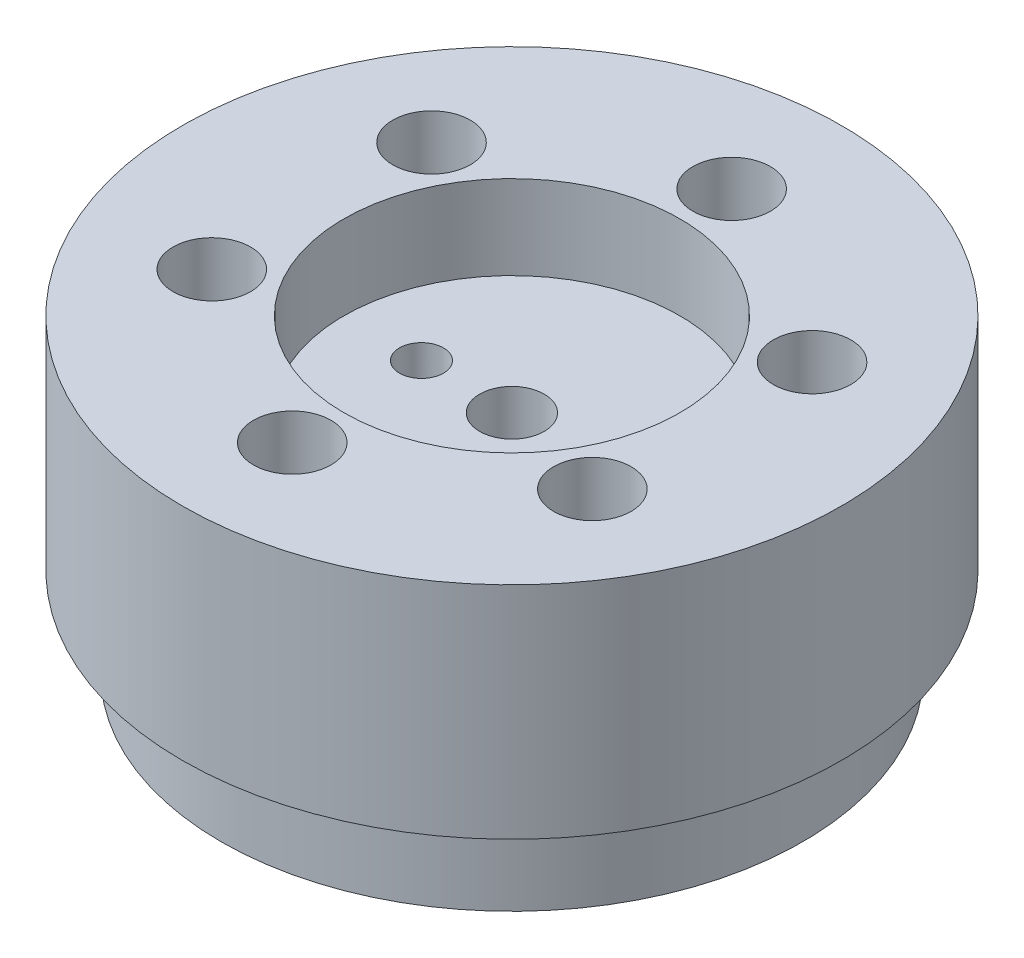
from build123d import *

# Parameters (mm, degrees)
SKETCH2_R            = 22.5
SKETCH2_R_2          = 1.7
SKETCH2_R_3          = 3
BOSS_EXTRUDE1_DEPTH  = 20
SKETCH2_6_R          = 22.5
SKETCH2_6_R_2        = 3
SKETCH2_6_R_3        = 13
SKETCH2_6_R_4        = 1.7
BOSS_EXTRUDE4_DEPTH  = 24
SKETCH2_8_W          = 22.604282846
SKETCH2_8_H          = 12.847038452
SKETCH2_8_R          = 2.5
CUT_EXTRUDE1_DEPTH   = 20
SKETCH2_9_W          = 22.604282846
SKETCH2_9_H          = 12.847038452
SKETCH2_9_R          = 1.7
SKETCH2_9_R_2        = 2.5
BOSS_EXTRUDE6_DEPTH  = 20
SKETCH2_10_W         = 22.604282846
SKETCH2_10_H         = 12.847038452
SKETCH2_10_R         = 1.7
SKETCH2_10_R_2       = 2.5
CUT_EXTRUDE2_DEPTH   = 15
FILLET3_R            = 3
SKETCH2_11_R         = 3
CUT_EXTRUDE3_DEPTH   = 24
CUT_EXTRUDE4_START   = -2.5
SKETCH3_R            = 13
CUT_EXTRUDE4_DEPTH   = 2.5
SKETCH2_13_R         = 3
SKETCH2_13_R_2       = 1.7
BOSS_EXTRUDE7_DEPTH  = 10
BOSS_EXTRUDE8_START  = -10
SKETCH4_R            = 25.5
SKETCH4_R_2          = 22.5
BOSS_EXTRUDE8_DEPTH  = 14
SKETCH5_R            = 3
SKETCH5_R_2          = 2.5
SKETCH5_R_3          = 1.7
BOSS_EXTRUDE9_DEPTH  = 2
SKETCH6_R            = 1.7
SKETCH6_R_2          = 2.5
BOSS_EXTRUDE10_DEPTH = 10
SKETCH7_R            = 2.5
SKETCH7_R_2          = 1.7
CUT_EXTRUDE5_DEPTH   = 4
BOSS_EXTRUDE11_START = -6.95
SKETCH4_2_R          = 25.5
SKETCH4_2_R_2        = 22.5
BOSS_EXTRUDE11_DEPTH = 3.05


with BuildPart() as part:
    # Sketch2 → Boss-Extrude1 (new body)
    with BuildSketch(Plane(origin=(0, 0, 0), x_dir=(1, 0, 0), z_dir=(0, 1, 0))):
        with Locations(Location((0, 0, 0), (0, 0, 270))):
            Circle(SKETCH2_R)
        with Locations(Location((-7, 0, 0), (0, 0, 270))):
            Circle(SKETCH2_R_2, mode=Mode.SUBTRACT)
        with Locations(Location((7, 0, 0), (0, 0, 270))):
            Circle(SKETCH2_R_2, mode=Mode.SUBTRACT)
        with Locations(Location((0, -17, 0), (0, 0, 270))):
            Circle(SKETCH2_R_2, mode=Mode.SUBTRACT)
        with Locations(Location((0, 17, 0), (0, 0, 270))):
            Circle(SKETCH2_R_2, mode=Mode.SUBTRACT)
        with Locations(Location((-14.722431864, -8.5, 0), (0, 0, 270))):
            Circle(SKETCH2_R_3, mode=Mode.SUBTRACT)
        with Locations(Location((-14.722431864, 8.5, 0), (0, 0, 270))):
            Circle(SKETCH2_R_3, mode=Mode.SUBTRACT)
        with Locations(Location((14.722431864, 8.5, 0), (0, 0, 270))):
            Circle(SKETCH2_R_3, mode=Mode.SUBTRACT)
        with Locations(Location((14.722431864, -8.5, 0), (0, 0, 270))):
            Circle(SKETCH2_R_3, mode=Mode.SUBTRACT)
    extrude(amount=BOSS_EXTRUDE1_DEPTH)

    # Sketch2<6> → Boss-Extrude4 (add)
    with BuildSketch(Plane(origin=(0, 0, 0), x_dir=(1, 0, 0), z_dir=(0, 1, 0))):
        with Locations(Location((0, 0, 0), (0, 0, 270))):
            Circle(SKETCH2_6_R)
        with Locations(Location((-14.722431864, -8.5, 0), (0, 0, 270))):
            Circle(SKETCH2_6_R_2, mode=Mode.SUBTRACT)
        with Locations(Location((14.722431864, -8.5, 0), (0, 0, 270))):
            Circle(SKETCH2_6_R_2, mode=Mode.SUBTRACT)
        with Locations(Location((-14.722431864, 8.5, 0), (0, 0, 270))):
            Circle(SKETCH2_6_R_2, mode=Mode.SUBTRACT)
        with Locations(Location((0, 0, 0), (0, 0, 270))):
            Circle(SKETCH2_6_R_3, mode=Mode.SUBTRACT)
        with Locations(Location((14.722431864, 8.5, 0), (0, 0, 270))):
            Circle(SKETCH2_6_R_2, mode=Mode.SUBTRACT)
        with Locations(Location((0, 17, 0), (0, 0, 270))):
            Circle(SKETCH2_6_R_4, mode=Mode.SUBTRACT)
        with Locations(Location((0, -17, 0), (0, 0, 270))):
            Circle(SKETCH2_6_R_4, mode=Mode.SUBTRACT)
    extrude(amount=BOSS_EXTRUDE4_DEPTH)

    # Sketch2<8> → Cut-Extrude1 (cut)
    # profile 1 of 2: a face of its own
    with BuildSketch(Plane(origin=(0, 0, 0), x_dir=(1, 0, 0), z_dir=(0, 1, 0))):
        Rectangle(SKETCH2_8_W, SKETCH2_8_H)
        Circle(SKETCH2_8_R, mode=Mode.SUBTRACT)
    # profile 2 of 2: a face of its own
    with BuildSketch(Plane(origin=(0, 0, 0), x_dir=(1, 0, 0), z_dir=(0, 1, 0))):
        Circle(SKETCH2_8_R)
    extrude(amount=CUT_EXTRUDE1_DEPTH, mode=Mode.SUBTRACT)

    # Sketch2<9> → Boss-Extrude6 (add)
    with BuildSketch(Plane(origin=(0, 0, 0), x_dir=(1, 0, 0), z_dir=(0, 1, 0))):
        Rectangle(SKETCH2_9_W, SKETCH2_9_H)
        with Locations(Location((-7, 0, 0), (0, 0, 270))):
            Circle(SKETCH2_9_R, mode=Mode.SUBTRACT)
        with Locations(Location((0, 0, 0), (0, 0, 270))):
            Circle(SKETCH2_9_R_2, mode=Mode.SUBTRACT)
        with Locations(Location((7, 0, 0), (0, 0, 270))):
            Circle(SKETCH2_9_R, mode=Mode.SUBTRACT)
    extrude(amount=BOSS_EXTRUDE6_DEPTH)

    # Sketch2<10> → Cut-Extrude2 (cut)
    with BuildSketch(Plane(origin=(0, 0, 0), x_dir=(1, 0, 0), z_dir=(0, 1, 0))):
        Rectangle(SKETCH2_10_W, SKETCH2_10_H)
        with Locations(Location((7, 0, 0), (0, 0, 270))):
            Circle(SKETCH2_10_R, mode=Mode.SUBTRACT)
        with Locations(Location((-7, 0, 0), (0, 0, 270))):
            Circle(SKETCH2_10_R, mode=Mode.SUBTRACT)
        with Locations(Location((0, 0, 0), (0, 0, 270))):
            Circle(SKETCH2_10_R_2, mode=Mode.SUBTRACT)
    extrude(amount=CUT_EXTRUDE2_DEPTH, mode=Mode.SUBTRACT)

    # Fillet3
    fillet3_edges = [part.edges().sort_by_distance(p)[0] for p in [
        (-11.302141423, 7.5, 6.423519226),
        (11.302141423, 7.5, 6.423519226),
        (11.302141423, 7.5, -6.423519226),
        (-11.302141423, 7.5, -6.423519226),
    ]]
    fillet(fillet3_edges, radius=FILLET3_R)

    # Sketch2<11> → Cut-Extrude3 (cut)
    with BuildSketch(Plane(origin=(0, 0, 0), x_dir=(1, 0, 0), z_dir=(0, 1, 0))):
        with Locations(Location((0, 17, 0), (0, 0, 270))):
            Circle(SKETCH2_11_R)
        with Locations(Location((0, -17, 0), (0, 0, 270))):
            Circle(SKETCH2_11_R)
    extrude(amount=CUT_EXTRUDE3_DEPTH, mode=Mode.SUBTRACT)

    # Sketch3 → Cut-Extrude4 (cut)
    with BuildSketch(Plane(origin=(0, 20, 0), x_dir=(1, 0, 0), z_dir=(0, 1, 0)).offset(CUT_EXTRUDE4_START)):
        with Locations(Location((0, 0, 0), (0, 0, 270))):
            Circle(SKETCH3_R)
    extrude(amount=CUT_EXTRUDE4_DEPTH, mode=Mode.SUBTRACT)

    # Sketch2<13> → Boss-Extrude7 (add)
    # profile 1 of 6: a face of its own
    with BuildSketch(Plane(origin=(0, 0, 0), x_dir=(1, 0, 0), z_dir=(0, 1, 0))):
        with Locations(Location((-14.722431864, -8.5, 0), (0, 0, 270))):
            Circle(SKETCH2_13_R)
        with Locations(Location((-14.722431864, -8.5, 0), (0, 0, 270))):
            Circle(SKETCH2_13_R_2, mode=Mode.SUBTRACT)
    # profile 2 of 6: a face of its own
    with BuildSketch(Plane(origin=(0, 0, 0), x_dir=(1, 0, 0), z_dir=(0, 1, 0))):
        with Locations(Location((-14.722431864, 8.5, 0), (0, 0, 270))):
            Circle(SKETCH2_13_R)
        with Locations(Location((-14.722431864, 8.5, 0), (0, 0, 270))):
            Circle(SKETCH2_13_R_2, mode=Mode.SUBTRACT)
    # profile 3 of 6: a face of its own
    with BuildSketch(Plane(origin=(0, 0, 0), x_dir=(1, 0, 0), z_dir=(0, 1, 0))):
        with Locations(Location((14.722431864, 8.5, 0), (0, 0, 270))):
            Circle(SKETCH2_13_R)
        with Locations(Location((14.722431864, 8.5, 0), (0, 0, 270))):
            Circle(SKETCH2_13_R_2, mode=Mode.SUBTRACT)
    # profile 4 of 6: a face of its own
    with BuildSketch(Plane(origin=(0, 0, 0), x_dir=(1, 0, 0), z_dir=(0, 1, 0))):
        with Locations(Location((14.722431864, -8.5, 0), (0, 0, 270))):
            Circle(SKETCH2_13_R)
        with Locations(Location((14.722431864, -8.5, 0), (0, 0, 270))):
            Circle(SKETCH2_13_R_2, mode=Mode.SUBTRACT)
    # profile 5 of 6: a face of its own
    with BuildSketch(Plane(origin=(0, 0, 0), x_dir=(1, 0, 0), z_dir=(0, 1, 0))):
        with Locations(Location((0, 17, 0), (0, 0, 270))):
            Circle(SKETCH2_13_R)
        with Locations(Location((0, 17, 0), (0, 0, 270))):
            Circle(SKETCH2_13_R_2, mode=Mode.SUBTRACT)
    # profile 6 of 6: a face of its own
    with BuildSketch(Plane(origin=(0, 0, 0), x_dir=(1, 0, 0), z_dir=(0, 1, 0))):
        with Locations(Location((0, -17, 0), (0, 0, 270))):
            Circle(SKETCH2_13_R)
        with Locations(Location((0, -17, 0), (0, 0, 270))):
            Circle(SKETCH2_13_R_2, mode=Mode.SUBTRACT)
    extrude(amount=BOSS_EXTRUDE7_DEPTH)

    # Sketch4 → Boss-Extrude8 (add)
    with BuildSketch(Plane.XZ.offset(BOSS_EXTRUDE8_START)):
        with Locations(Location((0, 0, 0), (0, 0, 90))):
            Circle(SKETCH4_R)
        with Locations(Location((0, 0, 0), (0, 0, 90))):
            Circle(SKETCH4_R_2, mode=Mode.SUBTRACT)
    extrude(amount=-BOSS_EXTRUDE8_DEPTH)

    # Sketch5 → Boss-Extrude9 (add)
    # profile 1 of 12: a face of its own
    with BuildSketch(Plane(origin=(0, 10, 0), x_dir=(1, 0, 0), z_dir=(0, 1, 0))):
        with Locations(Location((-14.722431864, 8.5, 0), (0, 0, 270))):
            Circle(SKETCH5_R)
        with Locations((-14.722431864, 8.5)):
            Circle(SKETCH5_R_2, mode=Mode.SUBTRACT)
    # profile 2 of 12: a face of its own
    with BuildSketch(Plane(origin=(0, 10, 0), x_dir=(1, 0, 0), z_dir=(0, 1, 0))):
        with Locations((-14.722431864, 8.5)):
            Circle(SKETCH5_R_2)
        with Locations(Location((-14.722431864, 8.5, 0), (0, 0, 270))):
            Circle(SKETCH5_R_3, mode=Mode.SUBTRACT)
    # profile 3 of 12: a face of its own
    with BuildSketch(Plane(origin=(0, 10, 0), x_dir=(1, 0, 0), z_dir=(0, 1, 0))):
        with Locations(Location((0, 17, 0), (0, 0, 270))):
            Circle(SKETCH5_R)
        with Locations((0, 17)):
            Circle(SKETCH5_R_2, mode=Mode.SUBTRACT)
    # profile 4 of 12: a face of its own
    with BuildSketch(Plane(origin=(0, 10, 0), x_dir=(1, 0, 0), z_dir=(0, 1, 0))):
        with Locations((0, 17)):
            Circle(SKETCH5_R_2)
        with Locations(Location((0, 17, 0), (0, 0, 270))):
            Circle(SKETCH5_R_3, mode=Mode.SUBTRACT)
    # profile 5 of 12: a face of its own
    with BuildSketch(Plane(origin=(0, 10, 0), x_dir=(1, 0, 0), z_dir=(0, 1, 0))):
        with Locations(Location((14.722431864, 8.5, 0), (0, 0, 270))):
            Circle(SKETCH5_R)
        with Locations((14.722431864, 8.5)):
            Circle(SKETCH5_R_2, mode=Mode.SUBTRACT)
    # profile 6 of 12: a face of its own
    with BuildSketch(Plane(origin=(0, 10, 0), x_dir=(1, 0, 0), z_dir=(0, 1, 0))):
        with Locations((14.722431864, 8.5)):
            Circle(SKETCH5_R_2)
        with Locations(Location((14.722431864, 8.5, 0), (0, 0, 270))):
            Circle(SKETCH5_R_3, mode=Mode.SUBTRACT)
    # profile 7 of 12: a face of its own
    with BuildSketch(Plane(origin=(0, 10, 0), x_dir=(1, 0, 0), z_dir=(0, 1, 0))):
        with Locations(Location((14.722431864, -8.5, 0), (0, 0, 270))):
            Circle(SKETCH5_R)
        with Locations((14.722431864, -8.5)):
            Circle(SKETCH5_R_2, mode=Mode.SUBTRACT)
    # profile 8 of 12: a face of its own
    with BuildSketch(Plane(origin=(0, 10, 0), x_dir=(1, 0, 0), z_dir=(0, 1, 0))):
        with Locations((14.722431864, -8.5)):
            Circle(SKETCH5_R_2)
        with Locations(Location((14.722431864, -8.5, 0), (0, 0, 270))):
            Circle(SKETCH5_R_3, mode=Mode.SUBTRACT)
    # profile 9 of 12: a face of its own
    with BuildSketch(Plane(origin=(0, 10, 0), x_dir=(1, 0, 0), z_dir=(0, 1, 0))):
        with Locations(Location((0, -17, 0), (0, 0, 270))):
            Circle(SKETCH5_R)
        with Locations((0, -17)):
            Circle(SKETCH5_R_2, mode=Mode.SUBTRACT)
    # profile 10 of 12: a face of its own
    with BuildSketch(Plane(origin=(0, 10, 0), x_dir=(1, 0, 0), z_dir=(0, 1, 0))):
        with Locations((0, -17)):
            Circle(SKETCH5_R_2)
        with Locations(Location((0, -17, 0), (0, 0, 270))):
            Circle(SKETCH5_R_3, mode=Mode.SUBTRACT)
    # profile 11 of 12: a face of its own
    with BuildSketch(Plane(origin=(0, 10, 0), x_dir=(1, 0, 0), z_dir=(0, 1, 0))):
        with Locations(Location((-14.722431864, -8.5, 0), (0, 0, 270))):
            Circle(SKETCH5_R)
        with Locations((-14.722431864, -8.5)):
            Circle(SKETCH5_R_2, mode=Mode.SUBTRACT)
    # profile 12 of 12: a face of its own
    with BuildSketch(Plane(origin=(0, 10, 0), x_dir=(1, 0, 0), z_dir=(0, 1, 0))):
        with Locations((-14.722431864, -8.5)):
            Circle(SKETCH5_R_2)
        with Locations(Location((-14.722431864, -8.5, 0), (0, 0, 270))):
            Circle(SKETCH5_R_3, mode=Mode.SUBTRACT)
    extrude(amount=BOSS_EXTRUDE9_DEPTH)

    # Sketch6 → Boss-Extrude10 (add)
    with BuildSketch(Plane.XZ.offset(-15)):
        with BuildLine():
            Line((11.302141423, 3.423519226), (11.302141423, -3.423519226))
            ThreePointArc((11.302141423, -3.423519226), (10.423461767, -5.54483957), (8.302141423, -6.423519226))
            Line((8.302141423, -6.423519226), (-8.302141423, -6.423519226))
            ThreePointArc((-8.302141423, -6.423519226), (-10.423461767, -5.54483957), (-11.302141423, -3.423519226))
            Line((-11.302141423, -3.423519226), (-11.302141423, 3.423519226))
            ThreePointArc((-11.302141423, 3.423519226), (-10.423461767, 5.54483957), (-8.302141423, 6.423519226))
            Line((-8.302141423, 6.423519226), (8.302141423, 6.423519226))
            ThreePointArc((8.302141423, 6.423519226), (10.423461767, 5.54483957), (11.302141423, 3.423519226))
        make_face()
        with Locations(Location((7, 0, 0), (0, 0, 270))):
            Circle(SKETCH6_R, mode=Mode.SUBTRACT)
        with Locations(Location((0, 0, 0), (0, 0, 270))):
            Circle(SKETCH6_R_2, mode=Mode.SUBTRACT)
        with Locations(Location((-7, 0, 0), (0, 0, 270))):
            Circle(SKETCH6_R, mode=Mode.SUBTRACT)
    extrude(amount=BOSS_EXTRUDE10_DEPTH)

    # Sketch7 → Cut-Extrude5 (cut)
    # profile 1 of 2: a face of its own
    with BuildSketch(Plane.XZ.offset(-5)):
        with Locations(Location((-7, 0, 0), (0, 0, 270))):
            Circle(SKETCH7_R)
        with Locations(Location((-7, 0, 0), (0, 0, 270))):
            Circle(SKETCH7_R_2, mode=Mode.SUBTRACT)
    # profile 2 of 2: a face of its own
    with BuildSketch(Plane.XZ.offset(-5)):
        with Locations(Location((7, 0, 0), (0, 0, 270))):
            Circle(SKETCH7_R)
        with Locations(Location((7, 0, 0), (0, 0, 270))):
            Circle(SKETCH7_R_2, mode=Mode.SUBTRACT)
    extrude(amount=-CUT_EXTRUDE5_DEPTH, mode=Mode.SUBTRACT)

    # Sketch4<2> → Boss-Extrude11 (add)
    with BuildSketch(Plane.XZ.offset(BOSS_EXTRUDE11_START)):
        with Locations(Location((0, 0, 0), (0, 0, 90))):
            Circle(SKETCH4_2_R)
        with Locations(Location((0, 0, 0), (0, 0, 90))):
            Circle(SKETCH4_2_R_2, mode=Mode.SUBTRACT)
    extrude(amount=-BOSS_EXTRUDE11_DEPTH)


solid = part.part
